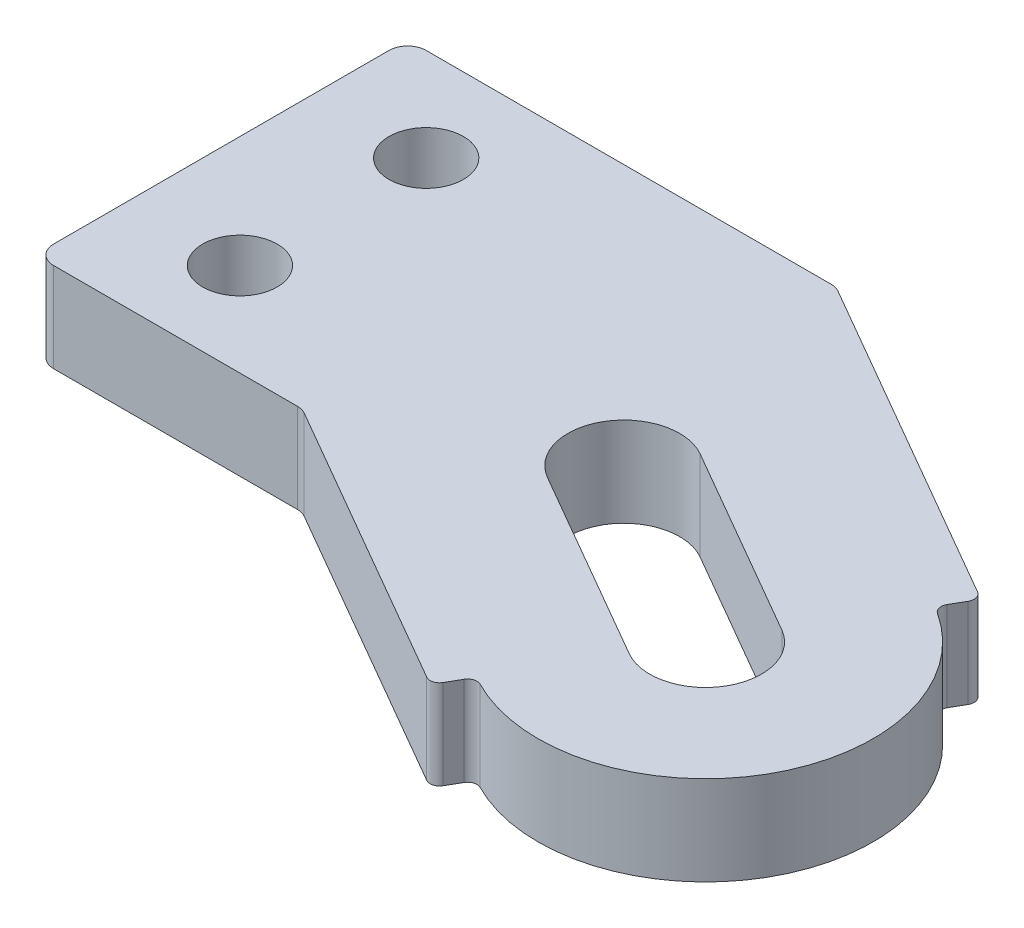
from build123d import *

# Parameters (mm, degrees)
SKETCH1_R           = 2.5
BOSS_EXTRUDE1_DEPTH = 6


with BuildPart() as part:
    # Sketch1 → Boss-Extrude1 (new body)
    with BuildSketch(Plane(origin=(0, 0, 0), x_dir=(1, 0, 0), z_dir=(0, 1, 0))):
        with BuildLine():
            Line((29.312544284, -14.726094949), (29.830902437, -13.828272291))
            ThreePointArc((29.830902437, -13.828272291), (29.893839703, -13.350216293), (29.600306432, -12.967676287))
            Line((29.600306432, -12.967676287), (7.429695757, -0.167468245))
            ThreePointArc((7.429695757, -0.167468245), (7.128219563, -0.042592717), (6.804695757, 0))
            Line((6.804695757, 0), (-20.369097563, 0))
            ThreePointArc((-20.369097563, 0), (-21.25298104, -0.366116524), (-21.619097563, -1.25))
            Line((-21.619097563, -1.25), (-21.619097563, -23.75))
            ThreePointArc((-21.619097563, -23.75), (-21.25298104, -24.633883476), (-20.369097563, -25))
            Line((-20.369097563, -25), (-4.014034054, -25))
            ThreePointArc((-4.014034054, -25), (-3.690510247, -25.042592717), (-3.389034054, -25.167468245))
            Line((-3.389034054, -25.167468245), (16.070306432, -36.402323713))
            ThreePointArc((16.070306432, -36.402323713), (16.548362431, -36.465260979), (16.930902437, -36.171727709))
            Line((16.930902437, -36.171727709), (17.44926059, -35.273905051))
            ThreePointArc((17.44926059, -35.273905051), (17.815716934, -34.984910861), (18.280480237, -35.027372208))
            ThreePointArc((18.280480237, -35.027372208), (33.123688229, -30.625), (29.514650402, -15.569218702))
            ThreePointArc((29.514650402, -15.569218702), (29.245496145, -15.187952547), (29.312544284, -14.726094949))
        make_face()
        with Locations(Location((-14.119097563, -18.75, 0), (0, 0, 270))):
            Circle(SKETCH1_R, mode=Mode.SUBTRACT)
        with Locations(Location((-14.119097563, -6.25, 0), (0, 0, 90))):
            Circle(SKETCH1_R, mode=Mode.SUBTRACT)
        with BuildLine():
            Line((25.255902437, -21.752404736), (12.26552138, -14.252404736))
            ThreePointArc((12.26552138, -14.252404736), (7.142926116, -15.625), (8.51552138, -20.747595264))
            Line((8.51552138, -20.747595264), (21.505902437, -28.247595264))
            ThreePointArc((21.505902437, -28.247595264), (26.628497701, -26.875), (25.255902437, -21.752404736))
        make_face(mode=Mode.SUBTRACT)
    extrude(amount=BOSS_EXTRUDE1_DEPTH)


solid = part.part
